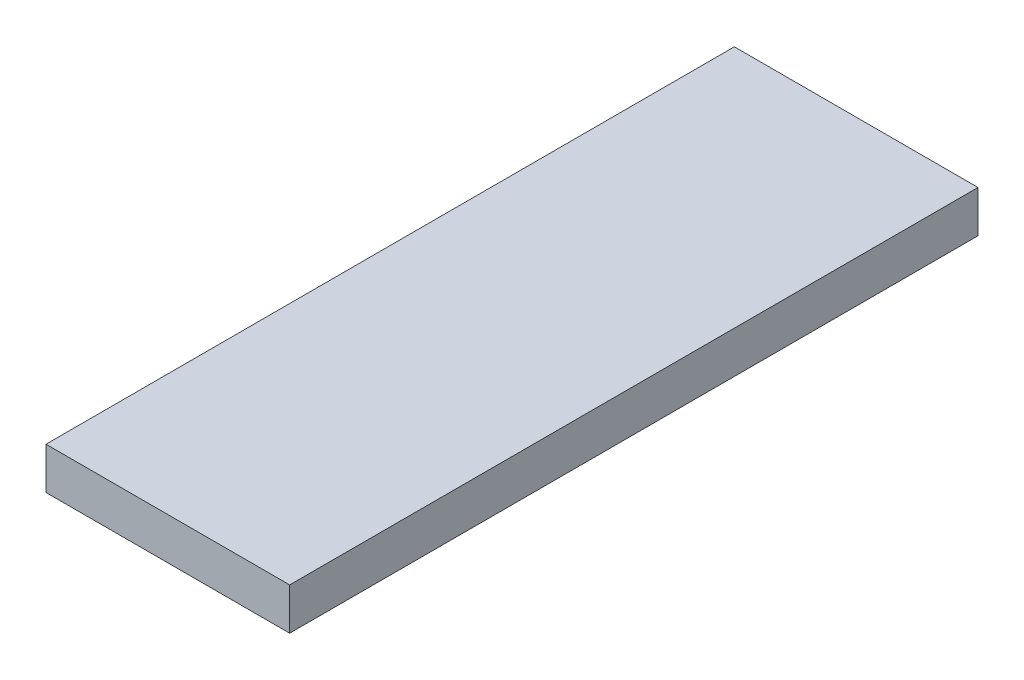
from build123d import *
from build123d.topology import SkipClean

# Parameters (mm, degrees)
SKETCH1_W               = 40
SKETCH1_H               = 40
SKETCH1_R               = 1.6
SKETCH1_R_2             = 11.25
BOSS_EXTRUDE1_DEPTH     = 8
CHAMFER2_SIZE           = 1
CHAMFER4_SIZE           = 1.3
BOSS_EXTRUDE2_DEPTH     = 5
BOSS_EXTRUDE3_DEPTH     = 40
CUT_EXTRUDE1_DEPTH      = 157.099755039
CUT_EXTRUDE1_DEPTH_BACK = 157.099755039
SKETCH6_W               = 7
SKETCH6_H               = 9.179407211
CUT_EXTRUDE2_START      = -40
SKETCH7_W               = 9.179407211
SKETCH7_H               = 6
CUT_EXTRUDE2_DEPTH      = 40
BOSS_EXTRUDE4_DEPTH     = 10
SKETCH12_W              = 108.011854904
SKETCH12_H              = 137.560499443
CUT_EXTRUDE4_DEPTH      = 165.39530252
SKETCH13_W              = 40
SKETCH13_H              = 6.869500557
BOSS_EXTRUDE7_DEPTH     = 113


with BuildPart() as part:
    # Sketch1 → Boss-Extrude1 (new body)
    with BuildSketch(Plane.XY):
        with Locations((-3.360655738, -3.504098361)):
            Rectangle(SKETCH1_W, SKETCH1_H)
        with Locations((-3.360655738, 12.745901639)):
            Circle(SKETCH1_R, mode=Mode.SUBTRACT)
        with Locations((12.889344262, -3.504098361)):
            Circle(SKETCH1_R, mode=Mode.SUBTRACT)
        with Locations((-3.360655738, -19.754098361)):
            Circle(SKETCH1_R, mode=Mode.SUBTRACT)
        with Locations((-19.610655738, -3.504098361)):
            Circle(SKETCH1_R, mode=Mode.SUBTRACT)
        with Locations((-3.360655738, -3.504098361)):
            Circle(SKETCH1_R_2, mode=Mode.SUBTRACT)
    extrude(amount=BOSS_EXTRUDE1_DEPTH)

    # Chamfer2
    chamfer2_edges = [part.edges().sort_by_distance(p)[0] for p in [
        (-4.960655738, 12.745901639, 0),
        (11.289344262, -3.504098361, 0),
        (-4.960655738, -19.754098361, 0),
        (-21.210655738, -3.504098361, 0),
    ]]
    chamfer(chamfer2_edges, length=CHAMFER2_SIZE)

    # Chamfer4
    chamfer4_edges = [part.edges().sort_by_distance(p)[0] for p in [
        (-14.610655738, -3.504098361, 0),
    ]]
    chamfer(chamfer4_edges, length=CHAMFER4_SIZE)

    # Sketch3 → Boss-Extrude2 (add)
    with SkipClean():  # the faces are left unmerged after this step: merging them gives an invalid solid
        with BuildSketch(Plane.XY.offset(8)):
            with BuildLine():
                Line((-15.860655738, -8.093801966), (-23.360655738, -8.093801966))
                Line((-23.360655738, -8.093801966), (-23.360655738, -23.504098361))
                Line((-23.360655738, -23.504098361), (-7.950359343, -23.504098361))
                Line((-7.950359343, -23.504098361), (-7.950359343, -16.004098361))
                Line((-7.950359343, -16.004098361), (-7.950359343, -13.775277495))
                ThreePointArc((-7.950359343, -13.775277495), (-11.315607026, -11.459049649), (-13.631834872, -8.093801966))
                Line((-13.631834872, -8.093801966), (-15.860655738, -8.093801966))
            make_face()
            with BuildLine():
                Line((-7.950359343, 8.995901639), (-7.950359343, 16.495901639))
                Line((-7.950359343, 16.495901639), (-23.360655738, 16.495901639))
                Line((-23.360655738, 16.495901639), (-23.360655738, 1.085605245))
                Line((-23.360655738, 1.085605245), (-15.860655738, 1.085605245))
                Line((-15.860655738, 1.085605245), (-13.631834872, 1.085605245))
                ThreePointArc((-13.631834872, 1.085605245), (-11.315607026, 4.450852928), (-7.950359343, 6.767080774))
                Line((-7.950359343, 6.767080774), (-7.950359343, 8.995901639))
            make_face()
            with BuildLine():
                Line((16.639344262, 16.495901639), (1.229047868, 16.495901639))
                Line((1.229047868, 16.495901639), (1.229047868, 8.995901639))
                Line((1.229047868, 8.995901639), (1.229047868, 6.767080774))
                ThreePointArc((1.229047868, 6.767080774), (4.594295551, 4.450852928), (6.910523397, 1.085605245))
                Line((6.910523397, 1.085605245), (9.139344262, 1.085605245))
                Line((9.139344262, 1.085605245), (16.639344262, 1.085605245))
                Line((16.639344262, 1.085605245), (16.639344262, 16.495901639))
            make_face()
            with BuildLine():
                Line((16.639344262, -23.504098361), (16.639344262, -8.093801966))
                Line((16.639344262, -8.093801966), (9.139344262, -8.093801966))
                Line((9.139344262, -8.093801966), (6.910523397, -8.093801966))
                ThreePointArc((6.910523397, -8.093801966), (4.594295551, -11.459049649), (1.229047868, -13.775277495))
                Line((1.229047868, -13.775277495), (1.229047868, -16.004098361))
                Line((1.229047868, -16.004098361), (1.229047868, -23.504098361))
                Line((1.229047868, -23.504098361), (16.639344262, -23.504098361))
            make_face()
        extrude(amount=BOSS_EXTRUDE2_DEPTH)

    # Sketch5 → Boss-Extrude3 (add)
    with SkipClean():  # the faces are left unmerged after this step: merging them gives an invalid solid
        with BuildSketch(Plane(origin=(16.639344262, 0, 0), x_dir=(0, 0, -1), z_dir=(1, 0, 0))):
            with BuildLine():
                Line((-13, 16.495901639), (-23, 16.495901639))
                ThreePointArc((-23, 16.495901639), (-30.071067812, 13.566969451), (-33, 6.495901639))
                Line((-33, 6.495901639), (-33, -79.864396018))
                Line((-33, -79.864396018), (-33, -127.934098361))
                Line((-33, -127.934098361), (0, -127.934098361))
                Line((0, -127.934098361), (80, -127.934098361))
                ThreePointArc((80, -127.934098361), (22.298563281, -89.279521012), (0, -23.504098361))
                Line((0, -23.504098361), (-13, -23.504098361))
                Line((-13, -23.504098361), (-13, 16.495901639))
            make_face()
        extrude(amount=-BOSS_EXTRUDE3_DEPTH)

    # Sketch6 → Cut-Extrude1 (cut, two sides: drawn at the far end of the back side and taken through both)
    with SkipClean():  # the faces are left unmerged after this step: merging them gives an invalid solid
        with BuildSketch(Plane(origin=(16.639344262, 0, 0), x_dir=(0, 0, -1), z_dir=(1, 0, 0)).offset(-CUT_EXTRUDE1_DEPTH_BACK)):
            with Locations((-16.5, -3.504098361)):
                Rectangle(SKETCH6_W, SKETCH6_H)
        extrude(amount=CUT_EXTRUDE1_DEPTH + CUT_EXTRUDE1_DEPTH_BACK, mode=Mode.SUBTRACT)

    # Sketch7 → Cut-Extrude2 (cut)
    with SkipClean():  # the faces are left unmerged after this step: merging them gives an invalid solid
        with BuildSketch(Plane(origin=(0, 16.495901639, 0), x_dir=(1, 0, 0), z_dir=(0, 1, 0)).offset(CUT_EXTRUDE2_START)):
            with Locations((-3.360655738, -16)):
                Rectangle(SKETCH7_W, SKETCH7_H)
        extrude(amount=CUT_EXTRUDE2_DEPTH, mode=Mode.SUBTRACT)

    # Sketch8 → Boss-Extrude4 (add)
    with SkipClean():  # the faces are left unmerged after this step: merging them gives an invalid solid
        with BuildSketch(Plane.XZ.offset(127.934098361)):
            Polygon((4.989344262, -32.93820323), (1.139344262, -26.01), (-7.160655738, -26.01), (-11.010655738, -32.93820323), (-7.010655738, -39.866406461), (0.989344262, -39.866406461), align=None)
            Polygon((4.839344262, -52.98679677), (0.839344262, -46.058593539), (-7.160655738, -46.058593539), (-11.160655738, -52.98679677), (-7.160655738, -59.915), (0.839344262, -59.915), align=None)
            Polygon((4.839344262, -13.02898385), (0.839344262, -6.10078062), (-7.160655738, -6.10078062), (-11.160655738, -13.02898385), (-7.160655738, -19.957187081), (0.839344262, -19.957187081), align=None)
            Polygon((4.839344262, 6.97179677), (0.839344262, 13.9), (-7.160655738, 13.9), (-11.160655738, 6.97179677), (-7.160655738, 0.043593539), (0.839344262, 0.043593539), align=None)
        extrude(amount=BOSS_EXTRUDE4_DEPTH)

    # Sketch12 → Cut-Extrude4 (cut, through all)
    with BuildSketch(Plane(origin=(16.639344262, 0, 0), x_dir=(0, 0, -1), z_dir=(1, 0, 0))):
        with Locations((21.005927452, -52.284348083)):
            Rectangle(SKETCH12_W, SKETCH12_H)
    extrude(amount=-CUT_EXTRUDE4_DEPTH, mode=Mode.SUBTRACT)

    # Sketch13 → Boss-Extrude7 (add, through all)
    with BuildSketch(Plane.XY.offset(33)):
        with Locations((-3.360655738, -124.499348083)):
            Rectangle(SKETCH13_W, SKETCH13_H)
    extrude(amount=-BOSS_EXTRUDE7_DEPTH)


solid = part.part
